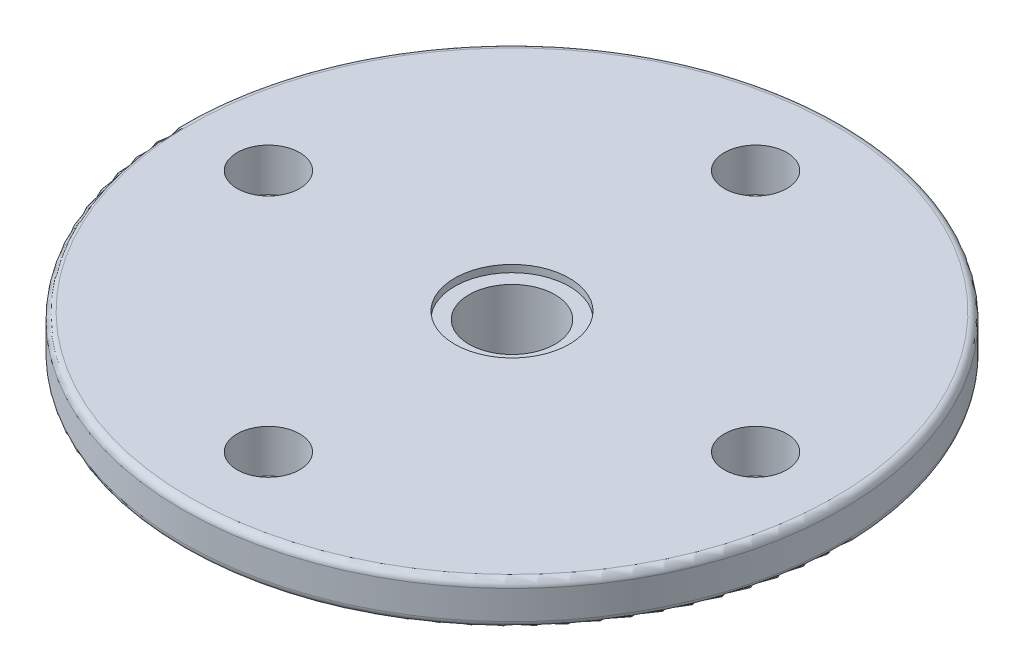
from build123d import *

# Parameters (mm, degrees)
SKETCH2_R           = 11.5
SKETCH2_R_2         = 1.5
BOSS_EXTRUDE1_DEPTH = 1.5
CUT_EXTRUDE1_START  = -0.25
SKETCH4_R           = 2
SKETCH4_R_2         = 1.5
CUT_EXTRUDE1_DEPTH  = 0.25
SKETCH5_R           = 1.09
CUT_EXTRUDE2_DEPTH  = 1.5
CIRPATTERN2_COUNT   = 4
BOSS_EXTRUDE3_START = 3
SKETCH6_R           = 1.75
SKETCH6_R_2         = 1.5
BOSS_EXTRUDE3_DEPTH = 3
FILLET1_R           = 0.25


with BuildPart() as part:
    # Sketch2 → Boss-Extrude1 (new body)
    with BuildSketch(Plane(origin=(0, 0, 0), x_dir=(1, 0, 0), z_dir=(0, 1, 0))):
        with Locations(Location((0, 0, 0), (0, 0, 270))):
            Circle(SKETCH2_R)
        with Locations(Location((0, 0, 0), (0, 0, 270))):
            Circle(SKETCH2_R_2, mode=Mode.SUBTRACT)
    extrude(amount=BOSS_EXTRUDE1_DEPTH)

    # Sketch4 → Cut-Extrude1 (cut)
    with BuildSketch(Plane(origin=(0, 1.5, 0), x_dir=(1, 0, 0), z_dir=(0, 1, 0)).offset(CUT_EXTRUDE1_START)):
        with Locations(Location((0, 0, 0), (0, 0, 270))):
            Circle(SKETCH4_R)
        with Locations(Location((0, 0, 0), (0, 0, 270))):
            Circle(SKETCH4_R_2, mode=Mode.SUBTRACT)
    extrude(amount=CUT_EXTRUDE1_DEPTH, mode=Mode.SUBTRACT)

    # Sketch5 → Cut-Extrude2 (cut)
    with BuildSketch(Plane(origin=(0, 1.5, 0), x_dir=(1, 0, 0), z_dir=(0, 1, 0))):
        with Locations(Location((0, 8.5, 0), (0, 0, 270))):
            Circle(SKETCH5_R)
    cut_extrude2 = extrude(amount=-CUT_EXTRUDE2_DEPTH, mode=Mode.SUBTRACT)

    # CirPattern2: Cut-Extrude2 ×4 about axis
    cirpattern2_axis = Axis((0, 0, 0), (0, 1, 0))
    for i in range(1, CIRPATTERN2_COUNT):
        add(cut_extrude2.rotate(cirpattern2_axis, i * 360 / CIRPATTERN2_COUNT), mode=Mode.SUBTRACT)

    # Sketch6 → Boss-Extrude3 (add)
    with BuildSketch(Plane(origin=(0, 0, 0), x_dir=(-1, 0, 0), z_dir=(0, -1, 0)).offset(BOSS_EXTRUDE3_START)):
        with Locations(Location((0, 0, 0), (0, 0, 270))):
            Circle(SKETCH6_R)
        with Locations(Location((0, 0, 0), (0, 0, 90))):
            Circle(SKETCH6_R_2, mode=Mode.SUBTRACT)
    extrude(amount=-BOSS_EXTRUDE3_DEPTH)

    # Fillet1
    fillet1_edges = [part.edges().sort_by_distance(p)[0] for p in [
        (0, 0, -11.5),
        (0, 1.5, -11.5),
    ]]
    fillet(fillet1_edges, radius=FILLET1_R)


solid = part.part
